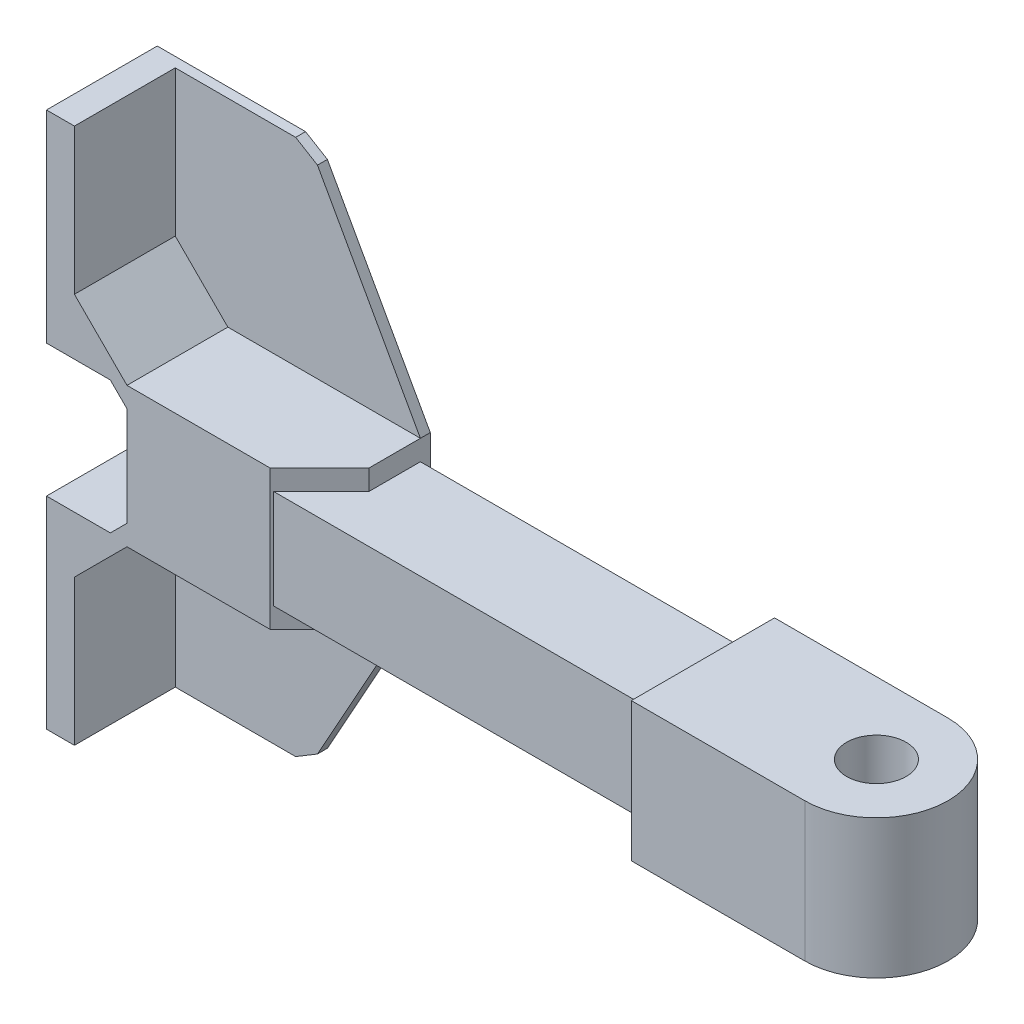
from build123d import *

# Parameters (mm, degrees)
BOSS_EXTRUDE3_START = -4
BOSS_EXTRUDE3_DEPTH = 28
SKETCH3_R           = 6
CUT_EXTRUDE1_DEPTH  = 28
BOSS_EXTRUDE4_START = 10
SKETCH5_W           = 77
SKETCH5_H           = 20
BOSS_EXTRUDE4_DEPTH = 10
BOSS_EXTRUDE5_DEPTH = 2
BOSS_EXTRUDE6_DEPTH = 54.1
CUT_EXTRUDE5_REACH  = 151.158
SKETCH9_W           = 9.998489886
SKETCH9_H           = 40


with BuildPart() as part:
    # Sketch1 → Boss-Extrude3 (new body)
    with BuildSketch(Plane(origin=(0, 0, 0), x_dir=(1, 0, 0), z_dir=(0, 1, 0)).offset(BOSS_EXTRUDE3_START)):
        with BuildLine():
            Line((117.93, 4.45), (82.93, 4.45))
            Line((82.93, 4.45), (82.93, -24.45))
            Line((82.93, -24.45), (117.93, -24.45))
            ThreePointArc((117.93, -24.45), (132.38, -10), (117.93, 4.45))
        make_face()
    extrude(amount=BOSS_EXTRUDE3_DEPTH)

    # Sketch3 → Cut-Extrude1 (cut)
    with BuildSketch(Plane(origin=(0, 24, 0), x_dir=(1, 0, 0), z_dir=(0, 1, 0))):
        with Locations(Location((117.93, -10, 0), (0, 0, 270))):
            Circle(SKETCH3_R)
    extrude(amount=-CUT_EXTRUDE1_DEPTH, mode=Mode.SUBTRACT)

    # Sketch5 → Boss-Extrude4 (add, symmetric)
    with BuildSketch(Plane(origin=(0, 0, 0), x_dir=(1, 0, 0), z_dir=(0, 1, 0)).offset(BOSS_EXTRUDE4_START)):
        with Locations((44.43, -10)):
            Rectangle(SKETCH5_W, SKETCH5_H)
    extrude(amount=BOSS_EXTRUDE4_DEPTH, both=True)

    # Sketch6 → Boss-Extrude5 (add)
    with BuildSketch(Plane.XY):
        Polygon((-39.16, 64.1), (-39.16, -44.1), (-9.24, -44.1), (-4.836934731, -41.448091963), (15.93, -4.1), (15.93, 24.1), (-4.836934731, 61.448091963), (-9.24, 64.1), align=None)
    extrude(amount=-BOSS_EXTRUDE5_DEPTH)

    # Sketch7 → Boss-Extrude6 (add, symmetric)
    with BuildSketch(Plane(origin=(0, 10, 0), x_dir=(-1, 0, 0), z_dir=(0, -1, 0))):
        Polygon((-15.93, 0), (-15.93, -10.35), (-5.931510114, -20.348489886), (26.278489886, -20.348489886), (39.16, -20.348489886), (39.16, 0), align=None)
    extrude(amount=BOSS_EXTRUDE6_DEPTH, both=True)

    # Cut-Extrude5: up to this face of the body (flat: up to its plane)
    cut_extrude5_end = Plane(part.part.faces().sort_by_distance((8.383659054, -30.874400728, 0))[0])
    # Sketch9 → Cut-Extrude5 (cut, up to the picked face)
    with BuildSketch(Plane.XY.offset(20.348489886), mode=Mode.PRIVATE) as cut_extrude5_sk1:
        with Locations((10.930755057, -24.1)):
            Rectangle(SKETCH9_W, SKETCH9_H)
    cut_extrude5_tool1 = split(extrude(cut_extrude5_sk1.sketch, amount=-CUT_EXTRUDE5_REACH, mode=Mode.PRIVATE), bisect_by=cut_extrude5_end, keep=Keep.BOTH, mode=Mode.PRIVATE)
    # Sketch9 → Cut-Extrude5 (cut, up to the picked face)
    with BuildSketch(Plane.XY.offset(20.348489886), mode=Mode.PRIVATE) as cut_extrude5_sk2:
        Polygon((5.931510114, -44.1), (5.931510114, -4.1), (-22.92, -4.1), (-33.526601718, -14.706601718), (-33.526601718, -44.1), align=None)
    cut_extrude5_tool2 = split(extrude(cut_extrude5_sk2.sketch, amount=-CUT_EXTRUDE5_REACH, mode=Mode.PRIVATE), bisect_by=cut_extrude5_end, keep=Keep.BOTH, mode=Mode.PRIVATE)
    # Sketch9 → Cut-Extrude5 (cut, up to the picked face)
    with BuildSketch(Plane.XY.offset(20.348489886), mode=Mode.PRIVATE) as cut_extrude5_sk3:
        with Locations((10.930755057, 44.1)):
            Rectangle(SKETCH9_W, SKETCH9_H)
    cut_extrude5_tool3 = split(extrude(cut_extrude5_sk3.sketch, amount=-CUT_EXTRUDE5_REACH, mode=Mode.PRIVATE), bisect_by=cut_extrude5_end, keep=Keep.BOTH, mode=Mode.PRIVATE)
    # Sketch9 → Cut-Extrude5 (cut, up to the picked face)
    with BuildSketch(Plane.XY.offset(20.348489886), mode=Mode.PRIVATE) as cut_extrude5_sk4:
        Polygon((-22.92, 24.1), (5.931510114, 24.1), (5.931510114, 64.1), (-33.526601718, 64.1), (-33.526601718, 34.706601718), align=None)
    cut_extrude5_tool4 = split(extrude(cut_extrude5_sk4.sketch, amount=-CUT_EXTRUDE5_REACH, mode=Mode.PRIVATE), bisect_by=cut_extrude5_end, keep=Keep.BOTH, mode=Mode.PRIVATE)
    # Sketch9 → Cut-Extrude5 (cut, up to the picked face)
    with BuildSketch(Plane.XY.offset(20.348489886), mode=Mode.PRIVATE) as cut_extrude5_sk5:
        Polygon((-22.92, 0), (-22.92, 20), (-26.278489886, 23.358489886), (-39.16, 23.358489886), (-39.16, -3.358489886), (-26.278489886, -3.358489886), align=None)
    cut_extrude5_tool5 = split(extrude(cut_extrude5_sk5.sketch, amount=-CUT_EXTRUDE5_REACH, mode=Mode.PRIVATE), bisect_by=cut_extrude5_end, keep=Keep.BOTH, mode=Mode.PRIVATE)
    add(cut_extrude5_tool1.solids().sort_by(Axis((10.930755, -24.1, 20.34849), (0, 0, -1)))[0], mode=Mode.SUBTRACT)
    add(cut_extrude5_tool2.solids().sort_by(Axis((-13.199096, -24.708463, 20.34849), (0, 0, -1)))[0], mode=Mode.SUBTRACT)
    add(cut_extrude5_tool3.solids().sort_by(Axis((10.930755, 44.1, 20.34849), (0, 0, -1)))[0], mode=Mode.SUBTRACT)
    add(cut_extrude5_tool4.solids().sort_by(Axis((-13.199096, 44.708463, 20.34849), (0, 0, -1)))[0], mode=Mode.SUBTRACT)
    add(cut_extrude5_tool5.solids().sort_by(Axis((-31.226846, 10, 20.34849), (0, 0, -1)))[0], mode=Mode.SUBTRACT)


solid = part.part
